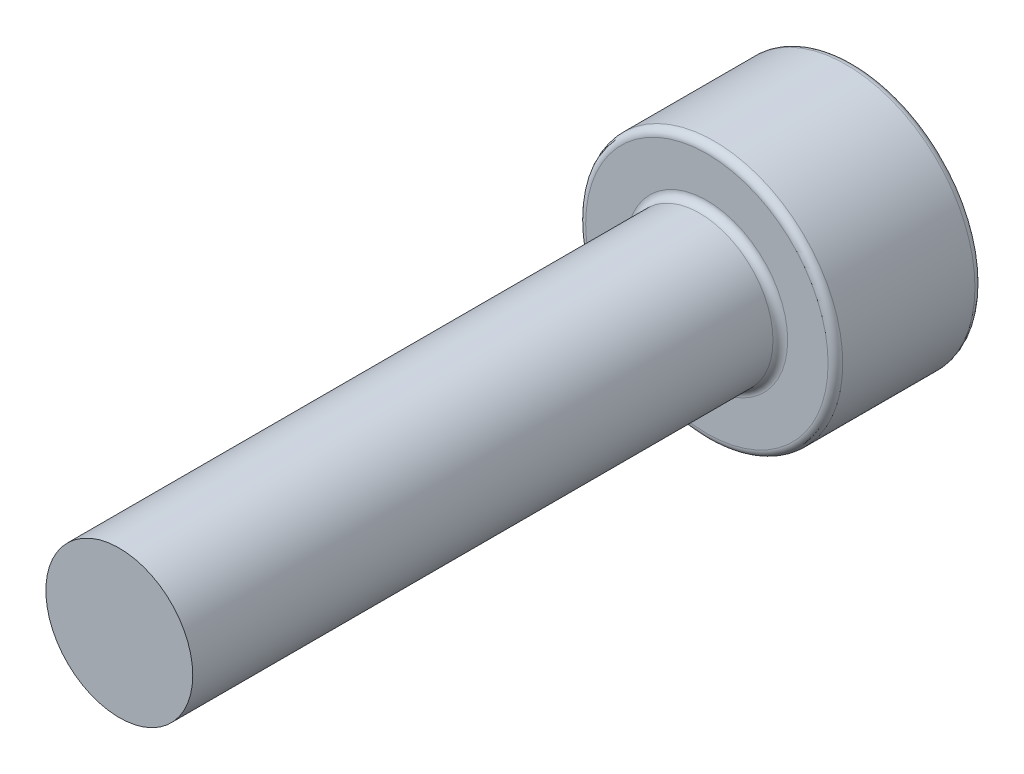
from build123d import *

# Parameters (mm, degrees)
ESQUISSE1_R        = 1.75
BOSS_EXTRU_1_DEPTH = 2
BOSS_EXTRU_2_START = -0.25
ESQUISSE3_R        = 1.75
BOSS_EXTRU_2_DEPTH = 0.25
ESQUISSE2_R        = 1
BOSS_EXTRU_3_DEPTH = 8
CONG_1_R           = 0.1


with BuildPart() as part:
    # Esquisse1 → Boss.-Extru.1 (new body)
    with BuildSketch(Plane.XY):
        Circle(ESQUISSE1_R)
        Polygon((0.577350269, -1), (1.154700538, 0), (0.577350269, 1), (-0.577350269, 1), (-1.154700538, 0), (-0.577350269, -1), align=None, mode=Mode.SUBTRACT)
    extrude(amount=BOSS_EXTRU_1_DEPTH)

    # Esquisse3 → Boss.-Extru.2 (add)
    with BuildSketch(Plane.XY.offset(2).offset(BOSS_EXTRU_2_START)):
        Circle(ESQUISSE3_R)
    extrude(amount=BOSS_EXTRU_2_DEPTH)

    # Esquisse2 → Boss.-Extru.3 (add)
    with BuildSketch(Plane.XY.offset(2)):
        Circle(ESQUISSE2_R)
    extrude(amount=BOSS_EXTRU_3_DEPTH)

    # Congé1
    cong_1_edges = [part.edges().sort_by_distance(p)[0] for p in [
        (-1.75, 0, 0),
        (-1, 0, 2),
        (-1.75, 0, 2),
    ]]
    fillet(cong_1_edges, radius=CONG_1_R)


solid = part.part
